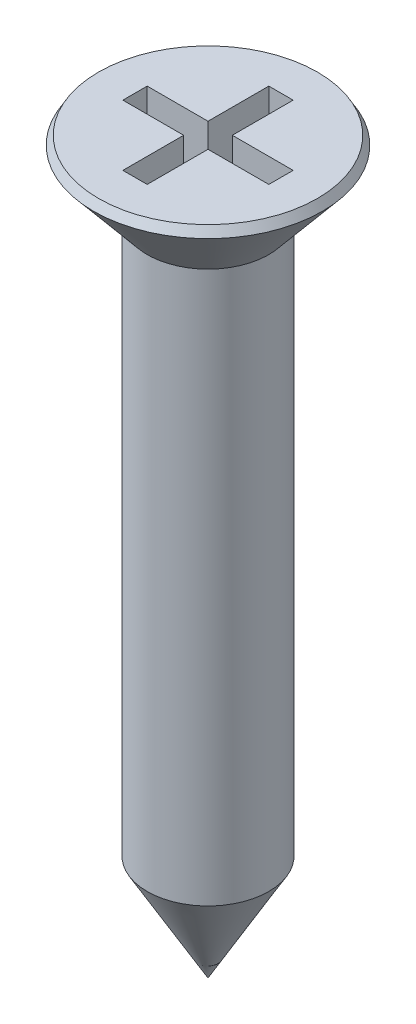
from build123d import *

# Parameters (mm, degrees)
CHAMFER_1_SIZE      = 0.1
CHAMFER_1_SIZE2     = 0.092274999
CUT_EXTRUDE_1_DEPTH = 0.4


with BuildPart() as part:
    # 草图1 → 旋转1 (revolve)
    with BuildSketch(Plane.XY, mode=Mode.PRIVATE) as revolve_1_sk:
        Polygon((0, 0), (0.5, 0.866025404), (0.5, 5.4), (1, 6), (0, 6), align=None)
    revolve(revolve_1_sk.sketch.rotate(Axis((0, 0, 0), (0, 1, 0)), 90), axis=Axis((0, 0, 0), (0, 1, 0)))

    # 倒角1
    chamfer_1_edges = [part.edges().sort_by_distance(p)[0] for p in [
        (0, 6, 1),
    ]]
    chamfer_1_side = [part.faces().sort_by_distance(p)[0] for p in [
        (0, 6, 0),
    ]]
    chamfer(chamfer_1_edges, length=CHAMFER_1_SIZE, length2=CHAMFER_1_SIZE2, reference=chamfer_1_side[0])

    # 草图2 → 切除-拉伸1 (cut)
    with BuildSketch(Plane(origin=(0, 6, 0), x_dir=(1, 0, 0), z_dir=(0, 1, 0))):
        Polygon((-0.6, -0.1), (-0.1, -0.1), (-0.1, -0.6), (0.1, -0.6), (0.1, -0.1), (0.6, -0.1), (0.6, 0.1), (0.1, 0.1), (0.1, 0.6), (-0.1, 0.6), (-0.1, 0.1), (-0.6, 0.1), align=None)
    extrude(amount=-CUT_EXTRUDE_1_DEPTH, mode=Mode.SUBTRACT)


solid = part.part
